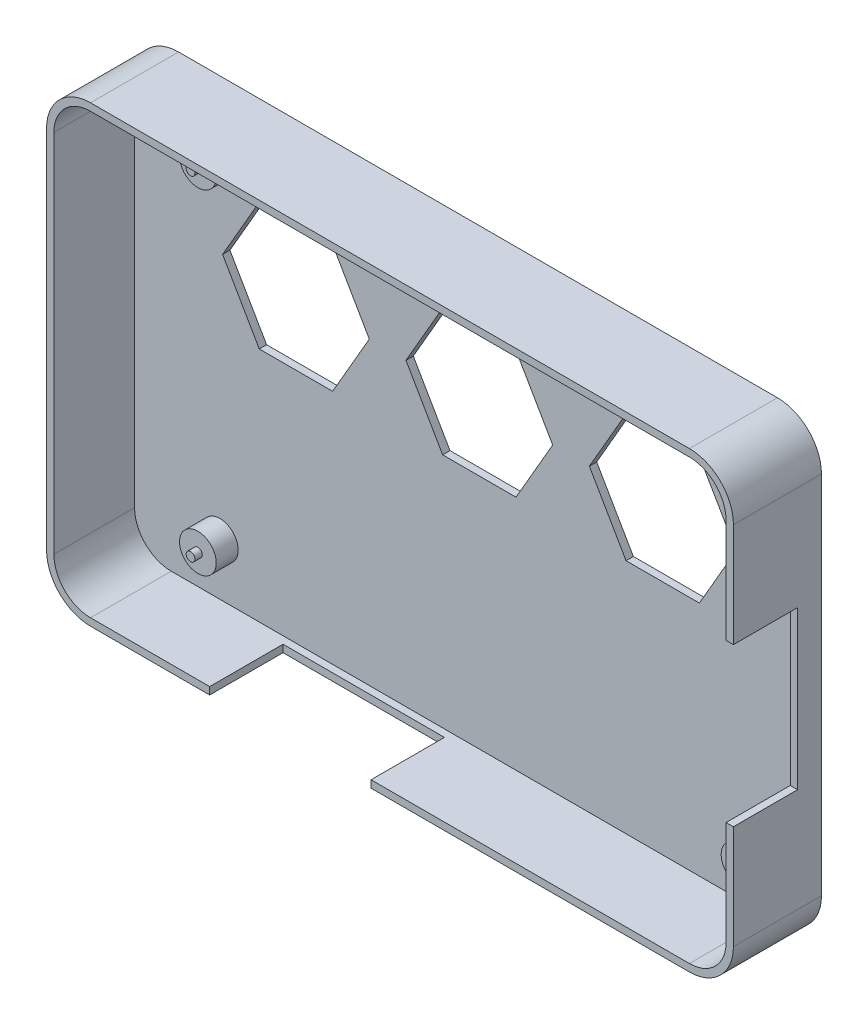
from build123d import *

# Parameters (mm, degrees)
SKIZZE1_W                       = 61.8
SKIZZE1_H                       = 93.64
AUFSATZ_LINEAR_AUSTRAGEN1_DEPTH = 12
VERRUNDUNG1_R                   = 6
WANDUNG1_T                      = -1
SKIZZE2_W                       = 21.5
SKIZZE2_H                       = 17.5
SCHNITT_LINEAR_AUSTRAGEN1_DEPTH = 6
SKIZZE3_W                       = 22
SKIZZE3_H                       = 10
SCHNITT_LINEAR_AUSTRAGEN2_DEPTH = 6
SCHNITT_LINEAR_AUSTRAGEN4_DEPTH = 6
LINEARES_MUSTER1_COUNT          = 3
LINEARES_MUSTER1_PITCH          = 25
SKIZZE5_R                       = 2.5
AUFSATZ_LINEAR_AUSTRAGEN2_DEPTH = 3
SKIZZE6_R                       = 0.6
AUFSATZ_LINEAR_AUSTRAGEN3_DEPTH = 1


with BuildPart() as part:
    # Skizze1 → Aufsatz-Linear austragen1 (new body)
    with BuildSketch(Plane(origin=(0, 0, 0), x_dir=(0, 1, 0), z_dir=(0, 0, 1))):
        Rectangle(SKIZZE1_W, SKIZZE1_H)
    extrude(amount=AUFSATZ_LINEAR_AUSTRAGEN1_DEPTH)

    # Verrundung1
    verrundung1_edges = [part.edges().sort_by_distance(p)[0] for p in [
        (46.82, 30.9, 6),
        (46.82, -30.9, 6),
        (-46.82, -30.9, 6),
        (-46.82, 30.9, 6),
    ]]
    fillet(verrundung1_edges, radius=VERRUNDUNG1_R)

    # Wandung1
    wandung1_openings = [part.faces().sort_by_distance(p)[0] for p in [
        (0, 0, 12),
    ]]
    offset(amount=WANDUNG1_T, openings=wandung1_openings, kind=Kind.INTERSECTION)

    # Skizze2 → Schnitt-Linear austragen1 (cut)
    with BuildSketch(Plane.YZ.offset(46.82)):
        with Locations((0, 12)):
            Rectangle(SKIZZE2_W, SKIZZE2_H)
    extrude(amount=-SCHNITT_LINEAR_AUSTRAGEN1_DEPTH, mode=Mode.SUBTRACT)

    # Skizze3 → Schnitt-Linear austragen2 (cut)
    with BuildSketch(Plane.XZ.offset(30.9)):
        with Locations((-13.58, 7)):
            Rectangle(SKIZZE3_W, SKIZZE3_H)
    extrude(amount=-SCHNITT_LINEAR_AUSTRAGEN2_DEPTH, mode=Mode.SUBTRACT)

    # Skizze4 → Schnitt-Linear austragen4 (cut)
    with BuildSketch(Plane(origin=(0, 0, 0), x_dir=(1, 0, 0), z_dir=(0, 0, -1))):
        Polygon((-18.82, -2.339745962), (-28.82, -2.339745962), (-33.82, -11), (-28.82, -19.660254038), (-18.82, -19.660254038), (-13.82, -11), align=None)
    schnitt_linear_austragen4 = extrude(amount=-SCHNITT_LINEAR_AUSTRAGEN4_DEPTH, mode=Mode.SUBTRACT)

    # Lineares Muster1: Schnitt-Linear austragen4 ×3
    with Locations(*[(i * LINEARES_MUSTER1_PITCH, 0, 0) for i in range(1, LINEARES_MUSTER1_COUNT)]):
        add(schnitt_linear_austragen4, mode=Mode.SUBTRACT)

    # Skizze5 → Aufsatz-Linear austragen2 (add)
    with BuildSketch(Plane.XY.offset(1)):
        with Locations(Location((-34.19, 22.7, 0), (0, 0, 180))):
            Circle(SKIZZE5_R)
        with Locations(Location((39.65, 22.7, 0), (0, 0, 180))):
            Circle(SKIZZE5_R)
        with Locations(Location((39.65, -22.86, 0), (0, 0, 180))):
            Circle(SKIZZE5_R)
        with Locations(Location((-34.19, -22.86, 0), (0, 0, 180))):
            Circle(SKIZZE5_R)
    extrude(amount=AUFSATZ_LINEAR_AUSTRAGEN2_DEPTH)

    # Skizze6 → Aufsatz-Linear austragen3 (add)
    with BuildSketch(Plane.XY.offset(4)):
        with Locations((-34.19, 22.7)):
            Circle(SKIZZE6_R)
        with Locations((-34.19, -22.86)):
            Circle(SKIZZE6_R)
        with Locations((39.65, -22.86)):
            Circle(SKIZZE6_R)
        with Locations((39.65, 22.7)):
            Circle(SKIZZE6_R)
    extrude(amount=AUFSATZ_LINEAR_AUSTRAGEN3_DEPTH)


solid = part.part
